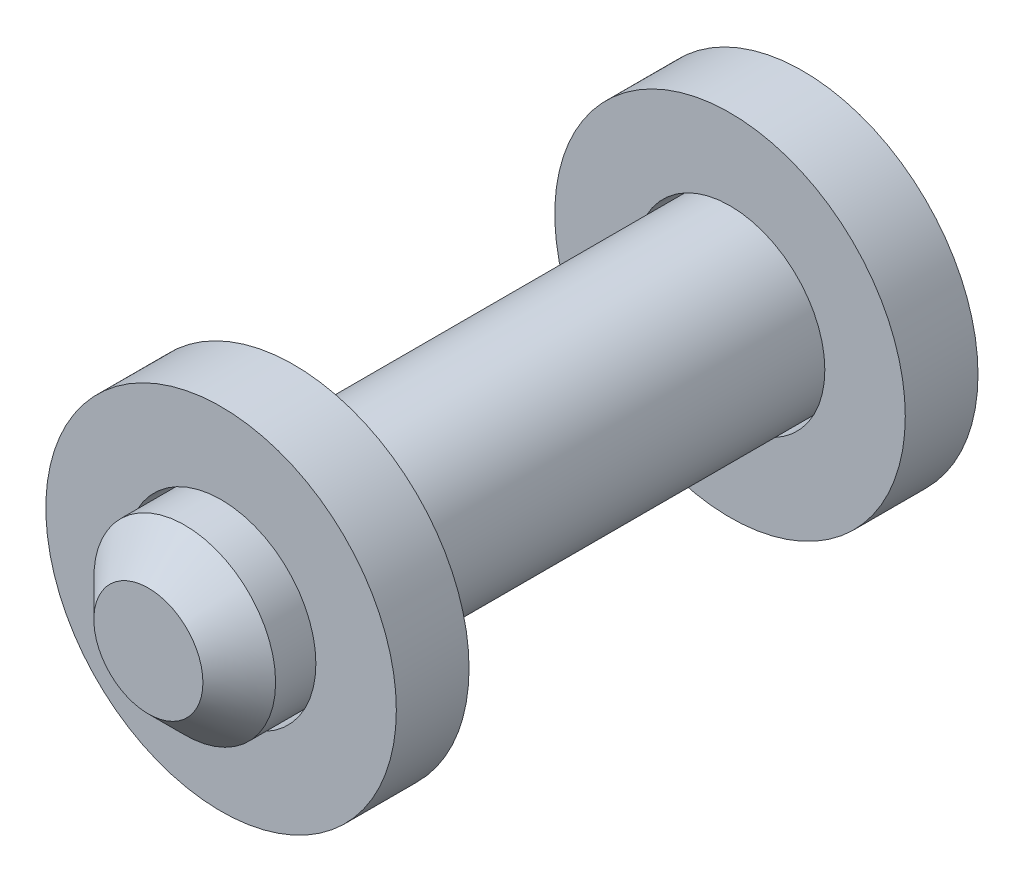
from build123d import *

# Parameters (mm, degrees)
SKETCH1_R           = 2.5
BOSS_EXTRUDE1_DEPTH = 10
CHAMFER1_SIZE       = 1
SKETCH2_R           = 4.820793463
SKETCH2_R_2         = 2.607744367
BOSS_EXTRUDE2_DEPTH = 2


with BuildPart() as part:
    # Sketch1 → Boss-Extrude1 (new, symmetric)
    with BuildSketch(Plane.XY):
        Circle(SKETCH1_R)
    extrude(amount=BOSS_EXTRUDE1_DEPTH, both=True)

    # Chamfer1
    chamfer1_edges = [part.edges().sort_by_distance(p)[0] for p in [
        (-2.5, 0, -10),
        (-2.5, 0, 10),
    ]]
    chamfer(chamfer1_edges, length=CHAMFER1_SIZE)


with BuildPart() as body_2:
    # Sketch2 → Boss-Extrude2 (new body)
    with BuildSketch(Plane.XY.offset(6)):
        Circle(SKETCH2_R)
        Circle(SKETCH2_R_2, mode=Mode.SUBTRACT)
    extrude(amount=BOSS_EXTRUDE2_DEPTH)


with BuildPart() as body_3:
    # Mirror2: mirrored copy
    add(body_2.part.mirror(Plane.XY))


solid = Compound([part.part, body_2.part, body_3.part])
